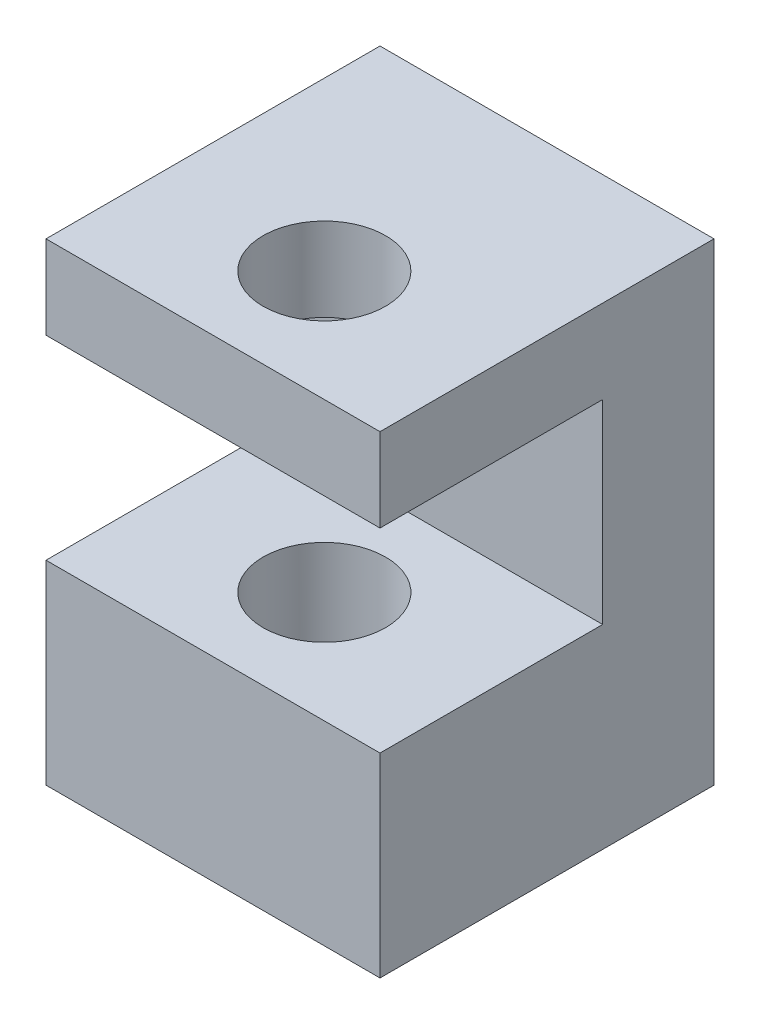
from build123d import *

# Parameters (mm, degrees)
SKETCH1_W               = 60
SKETCH1_H               = 60
BOSS_EXTRUDE1_DEPTH     = 85
SKETCH2_W               = 40
SKETCH2_H               = 35
CUT_EXTRUDE1_DEPTH      = 121.104121495
CUT_EXTRUDE2_DEPTH      = 99.488578018
CUT_EXTRUDE2_DEPTH_BACK = 99.488578018
SKETCH3_R               = 11


with BuildPart() as part:
    # Sketch1 → Boss-Extrude1 (new body)
    with BuildSketch(Plane(origin=(0, 0, 0), x_dir=(1, 0, 0), z_dir=(0, 1, 0))):
        with Locations((30, 30)):
            Rectangle(SKETCH1_W, SKETCH1_H)
    extrude(amount=BOSS_EXTRUDE1_DEPTH)

    # Sketch2 → Cut-Extrude1 (cut, through all)
    with BuildSketch(Plane(origin=(60, 0, 0), x_dir=(0, 0, -1), z_dir=(1, 0, 0))):
        with Locations((20, 52.5)):
            Rectangle(SKETCH2_W, SKETCH2_H)
    extrude(amount=-CUT_EXTRUDE1_DEPTH, mode=Mode.SUBTRACT)

    # Sketch3 → Cut-Extrude2 (cut, two sides: drawn at the far end of the back side and taken through both)
    with BuildSketch(Plane(origin=(0, 35, 0), x_dir=(1, 0, 0), z_dir=(0, 1, 0)).offset(-CUT_EXTRUDE2_DEPTH_BACK)):
        with Locations(Location((30, 20, 0), (0, 0, 270))):
            Circle(SKETCH3_R)
    extrude(amount=CUT_EXTRUDE2_DEPTH + CUT_EXTRUDE2_DEPTH_BACK, mode=Mode.SUBTRACT)


solid = part.part
